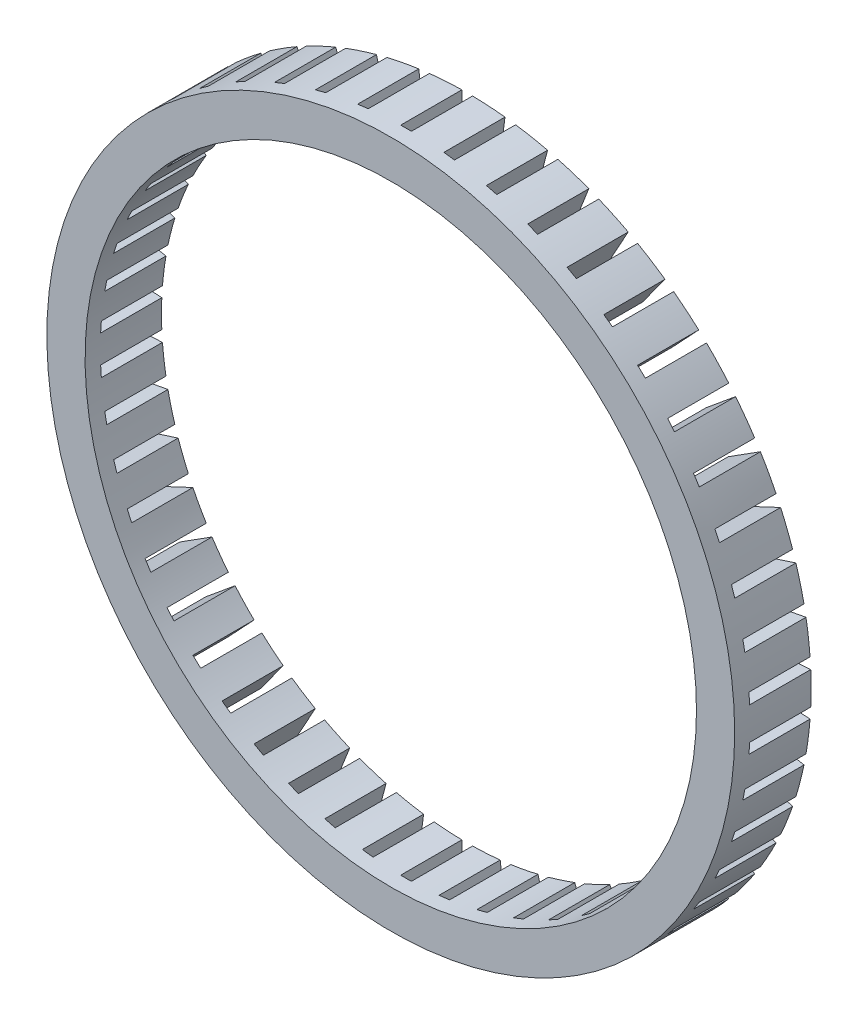
from build123d import *

# Parameters (mm, degrees)
SKETCH1_R           = 45
SKETCH1_R_2         = 40
BOSS_EXTRUDE1_DEPTH = 10
SKETCH3_W           = 1.4
SKETCH3_H           = 8
CUT_EXTRUDE1_DEPTH  = 65.420493634
CIRPATTERN1_COUNT   = 50


with BuildPart() as part:
    # Sketch1 → Boss-Extrude1 (new body)
    with BuildSketch(Plane.XY):
        Circle(SKETCH1_R)
        Circle(SKETCH1_R_2, mode=Mode.SUBTRACT)
    extrude(amount=BOSS_EXTRUDE1_DEPTH)

    # Sketch3 → Cut-Extrude1 (cut, symmetric)
    with BuildSketch(Plane(origin=(0, 0, 0), x_dir=(1, 0, 0), z_dir=(0, 1, 0))):
        with Locations((0, -4)):
            Rectangle(SKETCH3_W, SKETCH3_H)
    cut_extrude1 = extrude(amount=CUT_EXTRUDE1_DEPTH, both=True, mode=Mode.SUBTRACT)

    # CirPattern1: Cut-Extrude1 ×50 about axis
    cirpattern1_axis = Axis((0, 0, -0.5), (0, 0, 1))
    for i in range(1, CIRPATTERN1_COUNT):
        add(cut_extrude1.rotate(cirpattern1_axis, i * 360 / CIRPATTERN1_COUNT), mode=Mode.SUBTRACT)


solid = part.part
